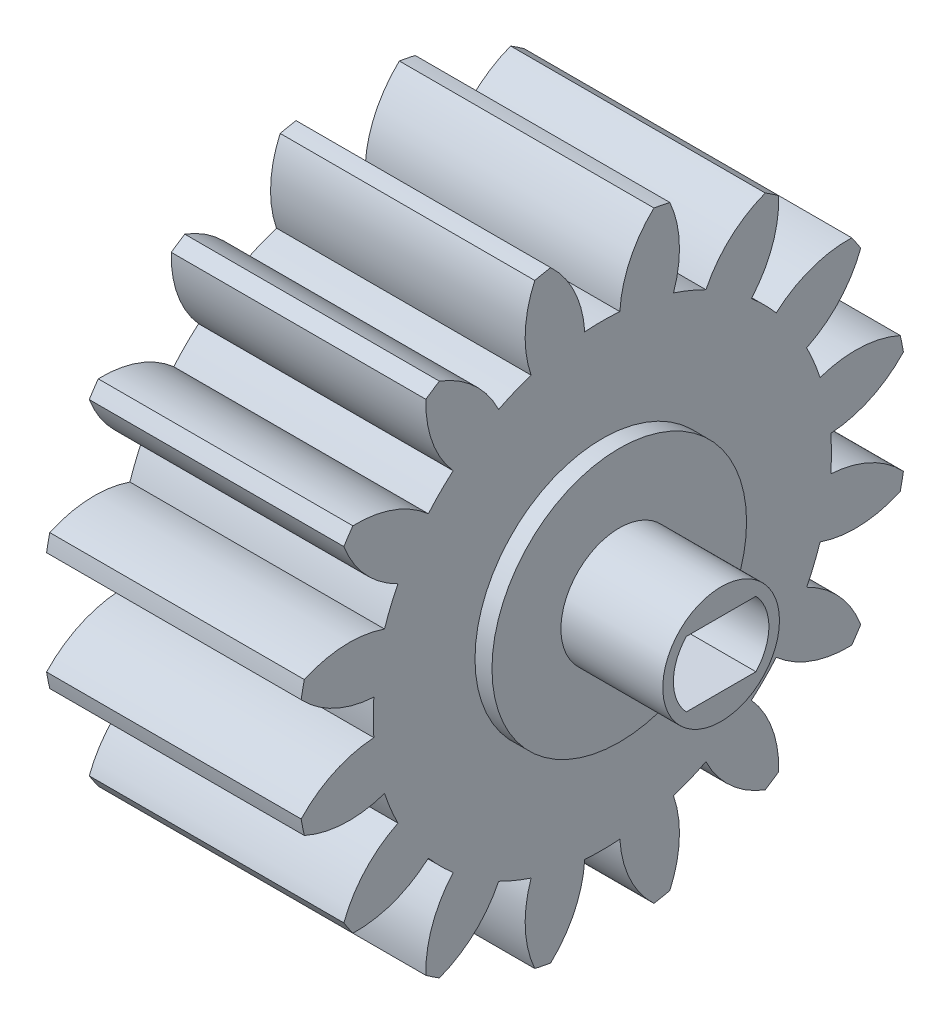
from build123d import *

# Parameters (mm, degrees)
BASPROSKE_W         = 15
BASPROSKE_H         = 18
TOOTHCUT_DEPTH      = 30.546573405
TEETHCUTS_COUNT     = 16
TEETHCUTS_ANGLE     = 337.5
HUBNEABOTSKE_R      = 5
HUBNEARBOTH_DEPTH   = 15.0000254
HUBFAR_START        = 15.0000254
HUBFARSKE_R         = 5
HUBFAR_DEPTH        = 15.0000254
BORSKE_R            = 2.5
BORE_DEPTH          = 45.0000508
CUT_EXTRUDE1_START  = -15.0000254
SKETCH3_R           = 5
CUT_EXTRUDE1_DEPTH  = 15.0000254
BOSS_EXTRUDE1_START = -20
SKETCH5_R           = 2.5
BOSS_EXTRUDE1_DEPTH = 20
BOSS_EXTRUDE2_START = 1
SKETCH6_R           = 7.5
SKETCH6_R_2         = 5
BOSS_EXTRUDE2_DEPTH = 1
SKETCH7_R           = 7.5
SKETCH7_R_2         = 3.4375
CUT_EXTRUDE2_DEPTH  = 30.757152718
BOSS_EXTRUDE3_START = 10.0000254
SKETCH8_R           = 2.5
BOSS_EXTRUDE3_DEPTH = 10.0000254
SKETCH10_OUTSIDE_W  = 49.174
SKETCH10_OUTSIDE_H  = 49.174
SKETCH10_OUTSIDE_R  = 3.4375
CUT_EXTRUDE3_DEPTH  = 14.0000254
CUT_EXTRUDE4_START  = -8
SKETCH12_R          = 3.4375
CUT_EXTRUDE4_DEPTH  = 8


with BuildPart() as part:
    # BasProSke → Base-Revolve (revolve)
    with BuildSketch(Plane(origin=(0, 0, 0), x_dir=(1, 0, 0), z_dir=(0, 1, 0)), mode=Mode.PRIVATE) as base_revolve_sk:
        with Locations((7.5, 9)):
            Rectangle(BASPROSKE_W, BASPROSKE_H)
    revolve(base_revolve_sk.sketch.rotate(Axis((-10, 0, 0), (1, 0, 0)), 180), axis=Axis((-10, 0, 0), (1, 0, 0)))

    # TooCutSke → ToothCut (cut, through all)
    with BuildSketch(Plane(origin=(0, 0, 0), x_dir=(0, 0, -1), z_dir=(1, 0, 0))):
        with BuildLine():
            ThreePointArc((1.03434411, 13.459313997), (0, 13.499), (-1.03434411, 13.459313997))
            ThreePointArc((-1.03434411, 13.459313997), (-1.635143665, 15.806872195), (-3.065655864, 17.762792553))
            ThreePointArc((-3.065655864, 17.762792553), (0, 18.0254), (3.065655864, 17.762792553))
            ThreePointArc((3.065655864, 17.762792553), (1.635143665, 15.806872195), (1.03434411, 13.459313997))
        make_face()
    toothcut = extrude(amount=TOOTHCUT_DEPTH, mode=Mode.SUBTRACT)

    # TeethCuts: ToothCut ×16 about axis
    teethcuts_axis = Axis((-10, 0, 0), (1, 0, 0))
    for i in range(1, TEETHCUTS_COUNT):
        add(toothcut.rotate(teethcuts_axis, i * TEETHCUTS_ANGLE / (TEETHCUTS_COUNT - 1)), mode=Mode.SUBTRACT)

    # HubNeaBotSke → HubNearBoth (add)
    with BuildSketch(Plane.ZY):
        with Locations(Location((0, 0, 0), (0, 0, 180))):
            Circle(HUBNEABOTSKE_R)
    extrude(amount=HUBNEARBOTH_DEPTH)

    # HubFarSke → HubFar (add)
    with BuildSketch(Plane(origin=(15, 0, 0), x_dir=(0, 0, -1), z_dir=(1, 0, 0)).offset(HUBFAR_START)):
        Circle(HUBFARSKE_R)
    extrude(amount=-HUBFAR_DEPTH)

    # BorSke → Bore (cut, symmetric)
    with BuildSketch(Plane(origin=(0, 0, 0), x_dir=(0, 0, -1), z_dir=(1, 0, 0))):
        with Locations(Location((0, 0, 0), (0, 0, 180))):
            Circle(BORSKE_R)
    extrude(amount=BORE_DEPTH, both=True, mode=Mode.SUBTRACT)

    # Sketch3 → Cut-Extrude1 (cut)
    with BuildSketch(Plane.ZY.offset(15.0000254).offset(CUT_EXTRUDE1_START)):
        Circle(SKETCH3_R)
    extrude(amount=CUT_EXTRUDE1_DEPTH, mode=Mode.SUBTRACT)

    # Sketch5 → Boss-Extrude1 (add)
    with BuildSketch(Plane.ZY.offset(BOSS_EXTRUDE1_START)):
        Circle(SKETCH5_R)
    extrude(amount=BOSS_EXTRUDE1_DEPTH)

    # Sketch6 → Boss-Extrude2 (add)
    with BuildSketch(Plane(origin=(15, 0, 0), x_dir=(0, 0, -1), z_dir=(1, 0, 0)).offset(BOSS_EXTRUDE2_START)):
        with Locations(Location((0, 0, 0), (0, 0, 180))):
            Circle(SKETCH6_R)
        Circle(SKETCH6_R_2, mode=Mode.SUBTRACT)
    extrude(amount=-BOSS_EXTRUDE2_DEPTH)

    # Sketch7 → Cut-Extrude2 (cut, through all)
    with BuildSketch(Plane(origin=(16, 0, 0), x_dir=(0, 0, -1), z_dir=(1, 0, 0))):
        with Locations(Location((0, 0, 0), (0, 0, 180))):
            Circle(SKETCH7_R)
        Circle(SKETCH7_R_2, mode=Mode.SUBTRACT)
    extrude(amount=CUT_EXTRUDE2_DEPTH, mode=Mode.SUBTRACT)

    # Sketch8 → Boss-Extrude3 (add)
    with BuildSketch(Plane(origin=(20, 0, 0), x_dir=(0, 0, -1), z_dir=(1, 0, 0)).offset(BOSS_EXTRUDE3_START)):
        Circle(SKETCH8_R)
    extrude(amount=-BOSS_EXTRUDE3_DEPTH)

    # Sketch10 outside → Cut-Extrude3 (cut)
    # profile 1 of 2: a face of its own
    with BuildSketch(Plane(origin=(30.0000254, 0, 0), x_dir=(0, 0, -1), z_dir=(1, 0, 0))):
        Rectangle(SKETCH10_OUTSIDE_W, SKETCH10_OUTSIDE_H)
        Circle(SKETCH10_OUTSIDE_R, mode=Mode.SUBTRACT)
    # profile 2 of 2: a face of its own
    with BuildSketch(Plane(origin=(30.0000254, 0, 0), x_dir=(0, 0, -1), z_dir=(1, 0, 0))):
        with BuildLine():
            Line((-2.050495367, 1.925), (2.050495367, 1.925))
            ThreePointArc((2.050495367, 1.925), (2.8125, 0), (2.050495367, -1.925))
            Line((2.050495367, -1.925), (-2.050495367, -1.925))
            ThreePointArc((-2.050495367, -1.925), (-2.8125, 0), (-2.050495367, 1.925))
        make_face()
    extrude(amount=-CUT_EXTRUDE3_DEPTH, mode=Mode.SUBTRACT)

    # Sketch12 → Cut-Extrude4 (cut)
    with BuildSketch(Plane(origin=(30.0000254, 0, 0), x_dir=(0, 0, -1), z_dir=(1, 0, 0)).offset(CUT_EXTRUDE4_START)):
        Circle(SKETCH12_R)
    extrude(amount=CUT_EXTRUDE4_DEPTH, mode=Mode.SUBTRACT)


solid = part.part
